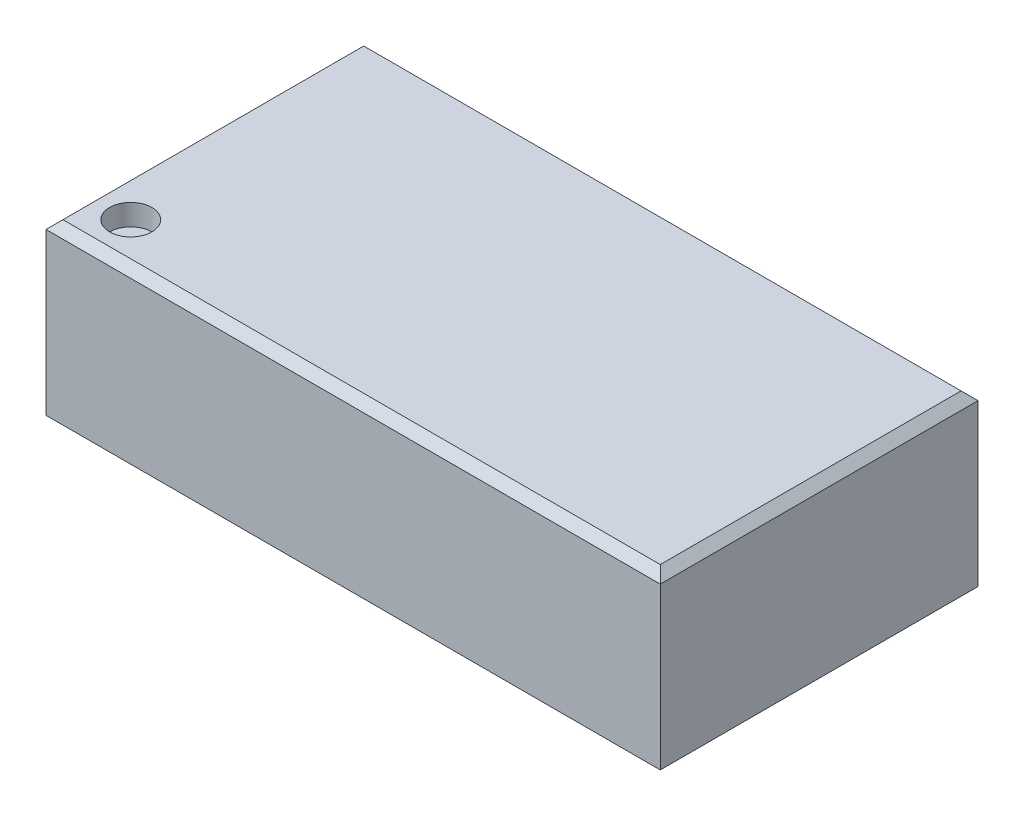
from build123d import *

# Parameters (mm, degrees)
ESQUISSE1_W             = 7.25
ESQUISSE1_H             = 3.75
BOSS_EXTRU_1_DEPTH      = 2
ESQUISSE2_R             = 0.25
ENL_V_MAT_EXTRU_1_DEPTH = 0.25
CHANFREIN1_SIZE         = 0.1


with BuildPart() as part:
    # Esquisse1 → Boss.-Extru.1 (new body)
    with BuildSketch(Plane(origin=(0, 0, 0), x_dir=(1, 0, 0), z_dir=(0, 1, 0))):
        Rectangle(ESQUISSE1_W, ESQUISSE1_H)
    extrude(amount=BOSS_EXTRU_1_DEPTH)

    # Esquisse2 → Enlèv. mat.-Extru.1 (cut)
    with BuildSketch(Plane(origin=(0, 2, 0), x_dir=(1, 0, 0), z_dir=(0, 1, 0))):
        with Locations(Location((-3.125, -1.375, 0), (0, 0, 270))):
            Circle(ESQUISSE2_R)
    extrude(amount=-ENL_V_MAT_EXTRU_1_DEPTH, mode=Mode.SUBTRACT)

    # Chanfrein1
    chanfrein1_edges = [part.edges().sort_by_distance(p)[0] for p in [
        (3.625, 2, 0),
        (0, 2, -1.875),
        (-3.625, 2, 0),
        (0, 2, 1.875),
    ]]
    chamfer(chanfrein1_edges, length=CHANFREIN1_SIZE)


solid = part.part
